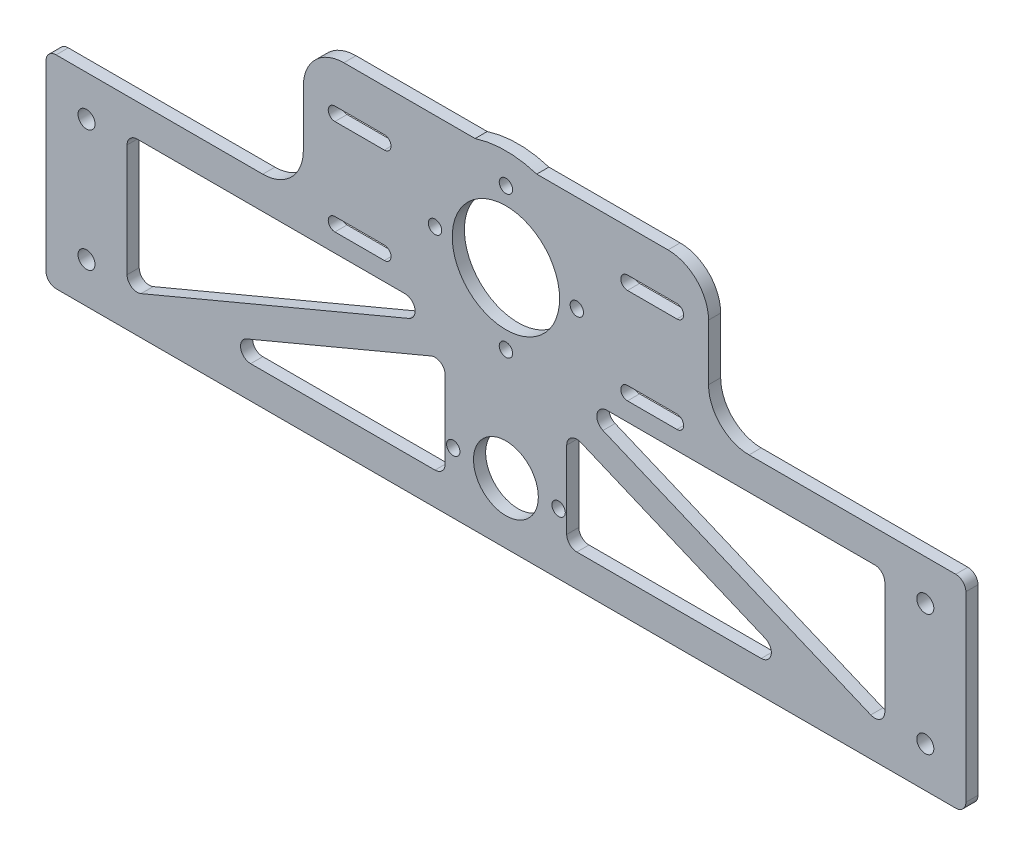
from build123d import *

# Parameters (mm, degrees)
SKETCH_1_R          = 13.25
SKETCH_1_R_2        = 1.65
SKETCH_1_R_3        = 2.1
SKETCH_1_R_4        = 8
EXTRUDE_1_DEPTH     = 3
FILLET_1_R          = 10
CUT_EXTRUDE_1_DEPTH = 3
FILLET_3_R          = 2.5
SKETCH_3_R          = 1.65
CUT_EXTRUDE_2_DEPTH = 129.418261941
CUT_EXTRUDE_3_DEPTH = 129.418261941


with BuildPart() as part:
    # 草图1 → 凸台-拉伸1 (new body)
    with BuildSketch(Plane.XY):
        with BuildLine():
            Line((113.5, -10), (113.5, -60))
            Line((113.5, -60), (-113.5, -60))
            Line((-113.5, -60), (-113.5, -10))
            Line((-113.5, -10), (-50, -10))
            Line((-50, -10), (-50, 23.815246989))
            Line((-50, 23.815246989), (-7.604867576, 23.815246989))
            ThreePointArc((-7.604867576, 23.815246989), (0, 25), (7.604867576, 23.815246989))
            Line((7.604867576, 23.815246989), (50, 23.815246989))
            Line((50, 23.815246989), (50, -10))
            Line((50, -10), (113.5, -10))
        make_face()
        Circle(SKETCH_1_R, mode=Mode.SUBTRACT)
        with Locations((0, 17.5)):
            Circle(SKETCH_1_R_2, mode=Mode.SUBTRACT)
        with Locations((-17.5, 0)):
            Circle(SKETCH_1_R_2, mode=Mode.SUBTRACT)
        with Locations((0, -17.5)):
            Circle(SKETCH_1_R_2, mode=Mode.SUBTRACT)
        with Locations((17.5, 0)):
            Circle(SKETCH_1_R_2, mode=Mode.SUBTRACT)
        with Locations((103.5, -20)):
            Circle(SKETCH_1_R_3, mode=Mode.SUBTRACT)
        with Locations((103.5, -50)):
            Circle(SKETCH_1_R_3, mode=Mode.SUBTRACT)
        with Locations((0, -45)):
            Circle(SKETCH_1_R_4, mode=Mode.SUBTRACT)
        with Locations(Location((-103.5, -50, 0), (0, 0, 180))):
            Circle(SKETCH_1_R_3, mode=Mode.SUBTRACT)
        with Locations(Location((-103.5, -20, 0), (0, 0, 180))):
            Circle(SKETCH_1_R_3, mode=Mode.SUBTRACT)
    extrude(amount=EXTRUDE_1_DEPTH)

    # 圆角1
    fillet_1_edges = [part.edges().sort_by_distance(p)[0] for p in [
        (50, 23.815246989, 1.5),
        (50, -10, 1.5),
        (-50, -10, 1.5),
        (-50, 23.815246989, 1.5),
    ]]
    fillet(fillet_1_edges, radius=FILLET_1_R)

    # 草图2 → 切除-拉伸1 (cut)
    with BuildSketch(Plane.XY.offset(3)):
        Polygon((-93.5, -18), (-93.5, -52), (-12.5, -18), align=None)
        Polygon((12.5, -18), (93.5, -18), (93.5, -52), align=None)
        Polygon((-75.413964744, -52), (-15, -26.641051836), (-15, -52), align=None)
        Polygon((15, -52), (75.413964744, -52), (15, -26.641051836), align=None)
    extrude(amount=-CUT_EXTRUDE_1_DEPTH, mode=Mode.SUBTRACT)

    # 圆角3
    fillet_3_edges = [part.edges().sort_by_distance(p)[0] for p in [
        (-15, -52, 1.5),
        (-75.413964744, -52, 1.5),
        (-15, -26.641051836, 1.5),
        (15, -52, 1.5),
        (15, -26.641051836, 1.5),
        (75.413964744, -52, 1.5),
        (93.5, -52, 1.5),
        (12.5, -18, 1.5),
        (93.5, -18, 1.5),
        (-93.5, -18, 1.5),
        (-12.5, -18, 1.5),
        (-93.5, -52, 1.5),
        (113.5, -10, 1.5),
        (113.5, -60, 1.5),
        (-113.5, -60, 1.5),
        (-113.5, -10, 1.5),
    ]]
    fillet(fillet_3_edges, radius=FILLET_3_R)

    # 草图3 → 切除-拉伸2 (cut, through all)
    with BuildSketch(Plane.XY.offset(3)):
        with Locations((-13, -45)):
            Circle(SKETCH_3_R)
        with Locations((13, -45)):
            Circle(SKETCH_3_R)
    extrude(amount=-CUT_EXTRUDE_2_DEPTH, mode=Mode.SUBTRACT)

    # 草图4 → 切除-拉伸3 (cut, through all)
    with BuildSketch(Plane.XY.offset(3)):
        with BuildLine():
            Line((-42.2, 13.45), (-30, 13.45))
            ThreePointArc((-30, 13.45), (-28.35, 11.8), (-30, 10.15))
            Line((-30, 10.15), (-42.2, 10.15))
            ThreePointArc((-42.2, 10.15), (-43.85, 11.8), (-42.2, 13.45))
        make_face()
        with BuildLine():
            Line((-42.2, -13.45), (-30, -13.45))
            ThreePointArc((-30, -13.45), (-28.35, -11.8), (-30, -10.15))
            Line((-30, -10.15), (-42.2, -10.15))
            ThreePointArc((-42.2, -10.15), (-43.85, -11.8), (-42.2, -13.45))
        make_face()
        with BuildLine():
            Line((42.2, 13.45), (30, 13.45))
            ThreePointArc((30, 13.45), (28.35, 11.8), (30, 10.15))
            Line((30, 10.15), (42.2, 10.15))
            ThreePointArc((42.2, 10.15), (43.85, 11.8), (42.2, 13.45))
        make_face()
        with BuildLine():
            Line((42.2, -13.45), (30, -13.45))
            ThreePointArc((30, -13.45), (28.35, -11.8), (30, -10.15))
            Line((30, -10.15), (42.2, -10.15))
            ThreePointArc((42.2, -10.15), (43.85, -11.8), (42.2, -13.45))
        make_face()
    extrude(amount=-CUT_EXTRUDE_3_DEPTH, mode=Mode.SUBTRACT)


solid = part.part
